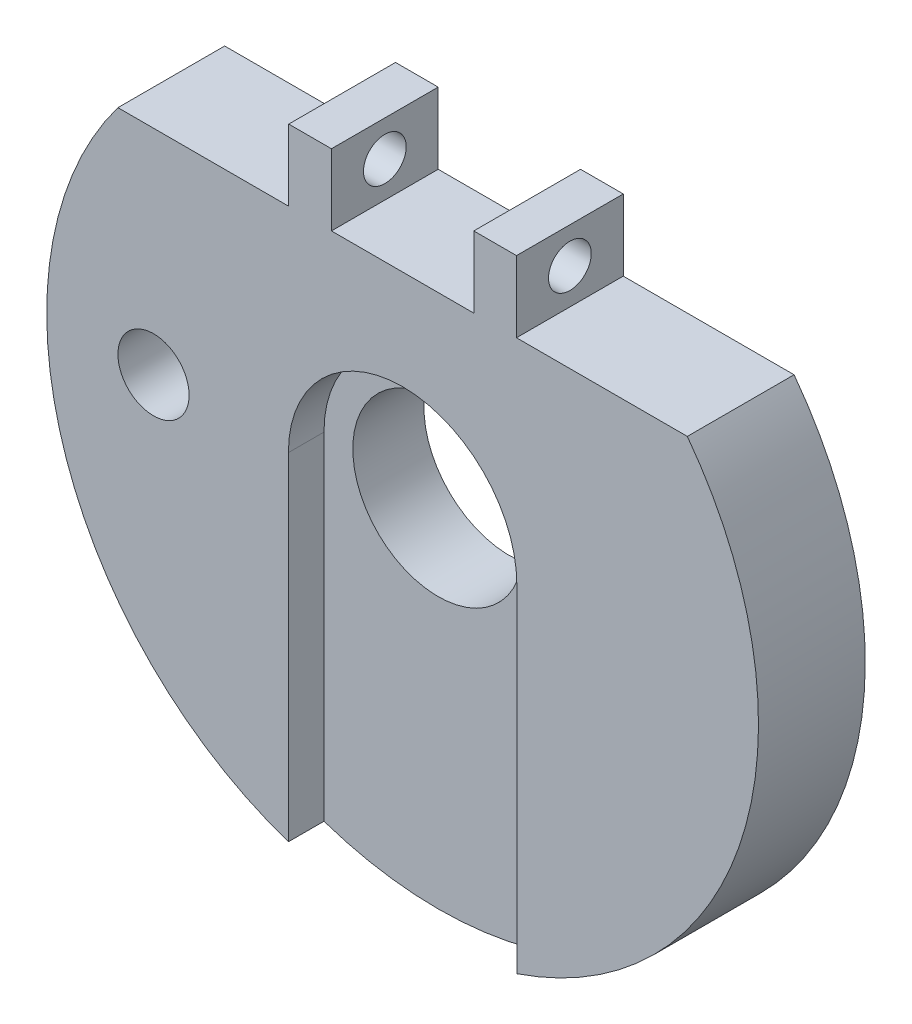
from build123d import *

# Parameters (mm, degrees)
ESTRUSIONE_ESTRUSIONE1_DEPTH                         = 15
TAGLIO_ESTRUSIONE1_DEPTH                             = 5
FORO_6_0_6_1_D                                       = 6
FORO_LAMATO_PER_BULLONE_M5_A_TESTA_ESAGO_D           = 7
FORO_LAMATO_PER_BULLONE_M5_A_TESTA_ESAGO_CBORE_D     = 10
FORO_LAMATO_PER_BULLONE_M5_A_TESTA_ESAGO_CBORE_DEPTH = 10
FORO_24_0_24_1_D                                     = 24


with BuildPart() as part:
    # Schizzo1 → Estrusione-Estrusione1 (new body)
    with BuildSketch(Plane.XY):
        with BuildLine():
            Line((-40, 30), (-16, 30))
            Line((-16, 30), (-16, 40))
            Line((-16, 40), (-10, 40))
            Line((-10, 40), (-10, 30))
            Line((-10, 30), (10, 30))
            Line((10, 30), (10, 40))
            Line((10, 40), (16, 40))
            Line((16, 40), (16, 30))
            Line((16, 30), (40, 30))
            ThreePointArc((40, 30), (0, -50), (-40, 30))
        make_face()
    extrude(amount=ESTRUSIONE_ESTRUSIONE1_DEPTH)

    # Schizzo2 → Taglio-Estrusione1 (cut)
    with BuildSketch(Plane.XY.offset(15)):
        with BuildLine():
            Line((-16.05, 0), (-16.05, -50))
            Line((-16.05, -50), (16.05, -50))
            Line((16.05, -50), (16.05, 0))
            ThreePointArc((16.05, 0), (0, 16.05), (-16.05, 0))
        make_face()
    extrude(amount=-TAGLIO_ESTRUSIONE1_DEPTH, mode=Mode.SUBTRACT)

    # Foro Ø6.0 (6)-1 (through all)
    with Locations(Plane.ZY.offset(16)):
        with Locations((7.5, 35)):
            Hole(FORO_6_0_6_1_D / 2)

    # Foro lamato per Bullone M5 a testa esagonale-1 (through all)
    with Locations(Plane.XY.offset(15)):
        with Locations((-35, 0)):
            CounterBoreHole(FORO_LAMATO_PER_BULLONE_M5_A_TESTA_ESAGO_D / 2, FORO_LAMATO_PER_BULLONE_M5_A_TESTA_ESAGO_CBORE_D / 2, FORO_LAMATO_PER_BULLONE_M5_A_TESTA_ESAGO_CBORE_DEPTH)

    # Foro Ø24.0 (24)-1 (through all)
    with Locations(Plane.XY.offset(10)):
        with Locations((0, 0)):
            Hole(FORO_24_0_24_1_D / 2)


solid = part.part
